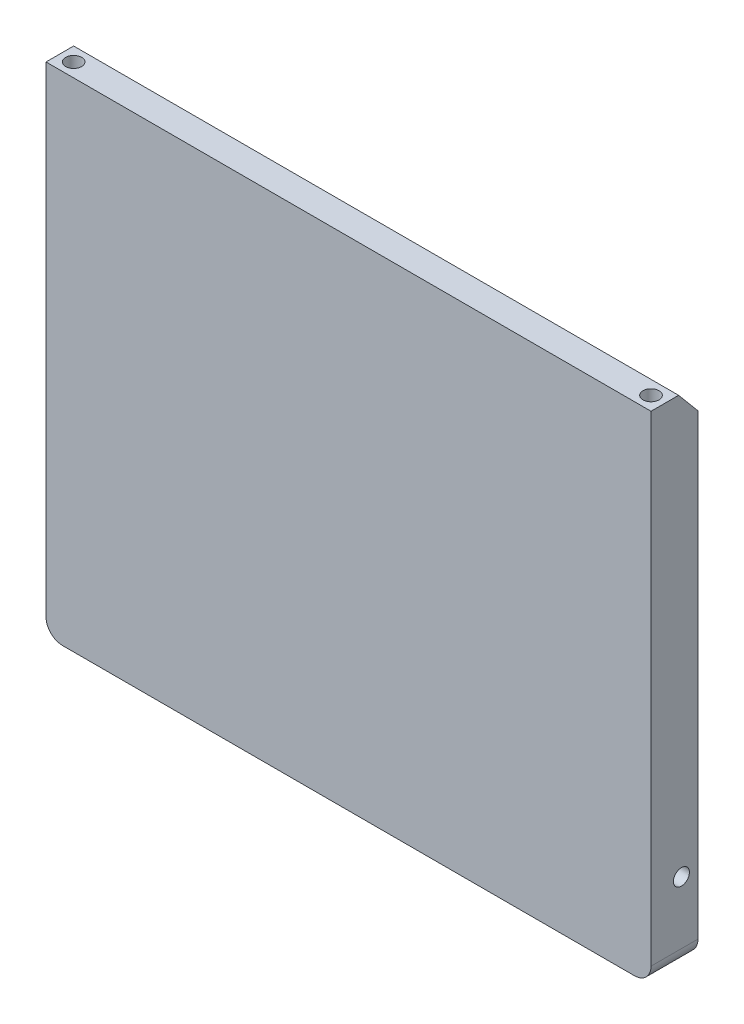
from build123d import *

# Parameters (mm, degrees)
SKETCH1_W           = 109.52
SKETCH1_H           = 90
BOSS_EXTRUDE1_DEPTH = 5
SKETCH2_R           = 1.45
CUT_EXTRUDE1_DEPTH  = 7
FILLET1_R           = 3
BOSS_EXTRUDE2_DEPTH = 3.5
CHAMFER1_SIZE       = 3.5
CHAMFER1_SIZE2      = 4.171137574
SKETCH5_W           = 100.2
SKETCH5_H           = 79.2
CUT_EXTRUDE3_DEPTH  = 6.5
SKETCH8_R           = 1.45
CUT_EXTRUDE5_DEPTH  = 3


with BuildPart() as part:
    # Sketch1 → Boss-Extrude1 (new body)
    with BuildSketch(Plane.XY):
        with Locations((49.453432203, -35.801949153)):
            Rectangle(SKETCH1_W, SKETCH1_H)
    extrude(amount=BOSS_EXTRUDE1_DEPTH)

    # Sketch2 → Cut-Extrude1 (cut)
    with BuildSketch(Plane(origin=(0, 9.198050847, 0), x_dir=(1, 0, 0), z_dir=(0, 1, 0))):
        with Locations(Location((-2.806567797, -2.5, 0), (0, 0, 270))):
            Circle(SKETCH2_R)
        with Locations(Location((101.713432203, -2.5, 0), (0, 0, 270))):
            Circle(SKETCH2_R)
    extrude(amount=-CUT_EXTRUDE1_DEPTH, mode=Mode.SUBTRACT)

    # Fillet1
    fillet1_edges = [part.edges().sort_by_distance(p)[0] for p in [
        (104.213432203, -80.801949153, 2.5),
        (-5.306567797, -80.801949153, 2.5),
    ]]
    fillet(fillet1_edges, radius=FILLET1_R)

    # Sketch4 → Boss-Extrude2 (add)
    with BuildSketch(Plane(origin=(0, 0, 0), x_dir=(-1, 0, 0), z_dir=(0, 0, -1))):
        with BuildLine():
            Line((-104.213432203, 9.198050847), (-104.213432203, -77.801949153))
            ThreePointArc((-104.213432203, -77.801949153), (-103.334752547, -79.923269496), (-101.213432203, -80.801949153))
            Line((-101.213432203, -80.801949153), (2.306567797, -80.801949153))
            ThreePointArc((2.306567797, -80.801949153), (4.42788814, -79.923269496), (5.306567797, -77.801949153))
            Line((5.306567797, -77.801949153), (5.306567797, 9.198050847))
            Line((5.306567797, 9.198050847), (-104.213432203, 9.198050847))
        make_face()
    extrude(amount=BOSS_EXTRUDE2_DEPTH)

    # Chamfer1
    chamfer1_edges = [part.edges().sort_by_distance(p)[0] for p in [
        (49.453432203, 9.198050847, -3.5),
    ]]
    chamfer1_side = [part.faces().sort_by_distance(p)[0] for p in [
        (49.453432203, 9.198050847, 0.724808812),
    ]]
    chamfer(chamfer1_edges, length=CHAMFER1_SIZE, length2=CHAMFER1_SIZE2, reference=chamfer1_side[0])

    # Sketch5 → Cut-Extrude3 (cut)
    with BuildSketch(Plane(origin=(0, 0, -3.5), x_dir=(-1, 0, 0), z_dir=(0, 0, -1))):
        with Locations((-49.453432203, -35.801949153)):
            Rectangle(SKETCH5_W, SKETCH5_H)
    extrude(amount=-CUT_EXTRUDE3_DEPTH, mode=Mode.SUBTRACT)

    # Sketch8 → Cut-Extrude5 (cut)
    with BuildSketch(Plane(origin=(104.213432203, 0, 0), x_dir=(0, 0, -1), z_dir=(1, 0, 0))):
        with Locations((0.5, -66.551949153)):
            Circle(SKETCH8_R)
    cut_extrude5 = extrude(amount=-CUT_EXTRUDE5_DEPTH, mode=Mode.SUBTRACT)

    # Mirror2: Cut-Extrude5 across plane
    add(cut_extrude5.mirror(Plane.ZY.offset(-49.453432203)), mode=Mode.SUBTRACT)


solid = part.part
